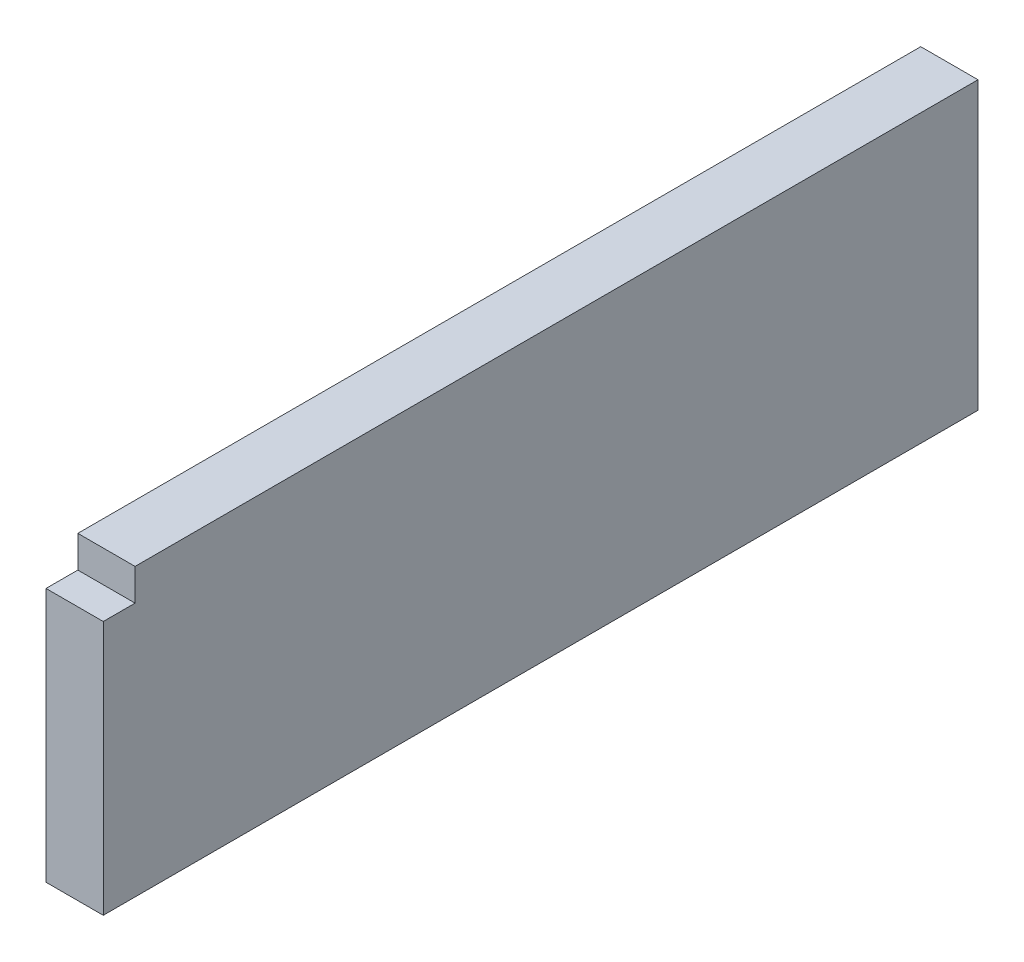
from build123d import *

# Parameters (mm, degrees)
BOSS_EXTRUDE1_DEPTH = 9


with BuildPart() as part:
    # Sketch1 → Boss-Extrude1 (new, symmetric)
    with BuildSketch(Plane(origin=(0, 0, 0), x_dir=(0, 0, -1), z_dir=(1, 0, 0))):
        Polygon((-137.5, 35), (-137.5, -45), (137.5, -45), (137.5, 45), (-127.5, 45), (-127.5, 35), align=None)
    extrude(amount=BOSS_EXTRUDE1_DEPTH, both=True)


solid = part.part
